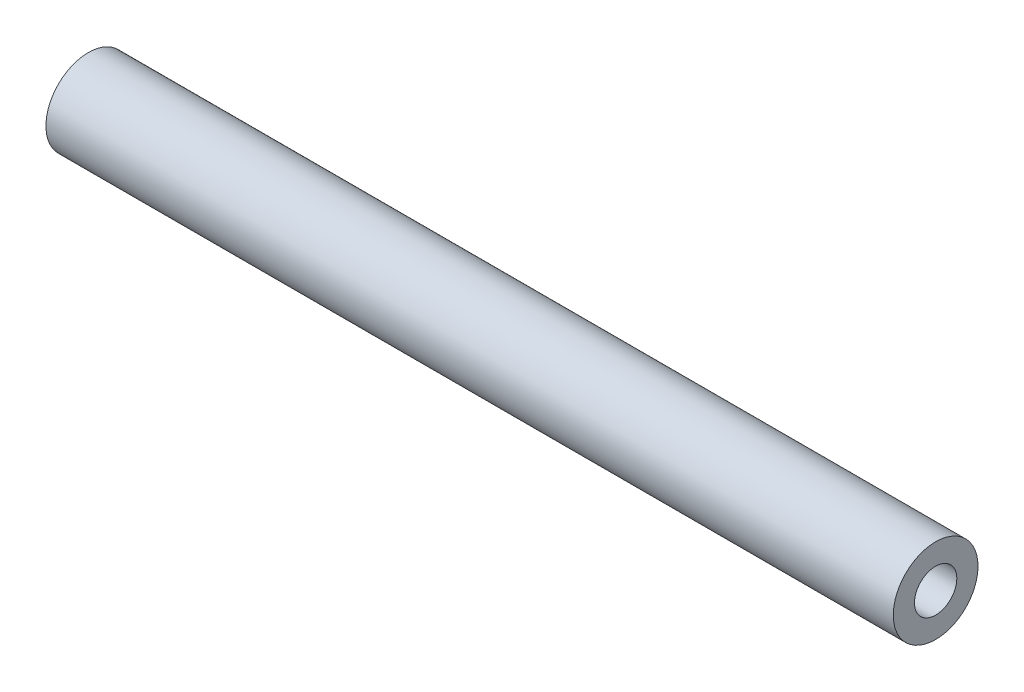
from build123d import *

# Parameters (mm, degrees)
SKETCH1_R           = 6.35
BOSS_EXTRUDE1_DEPTH = 63.5
SKETCH2_R           = 3.175
CUT_EXTRUDE1_DEPTH  = 128.317104114
SCALE1_SCALE        = 0.5


with BuildPart() as part:
    # Sketch1 → Boss-Extrude1 (new, symmetric)
    with BuildSketch(Plane(origin=(0, 0, 0), x_dir=(0, 0, -1), z_dir=(1, 0, 0))):
        Circle(SKETCH1_R)
    extrude(amount=BOSS_EXTRUDE1_DEPTH, both=True)

    # Sketch2 → Cut-Extrude1 (cut, through all)
    with BuildSketch(Plane(origin=(63.5, 0, 0), x_dir=(0, 0, -1), z_dir=(1, 0, 0))):
        Circle(SKETCH2_R)
    extrude(amount=-CUT_EXTRUDE1_DEPTH, mode=Mode.SUBTRACT)


with BuildPart() as part_1:
    # Scale1: scaled about (0, 0, 0)
    add(part.part.scale(SCALE1_SCALE))


solid = part_1.part
